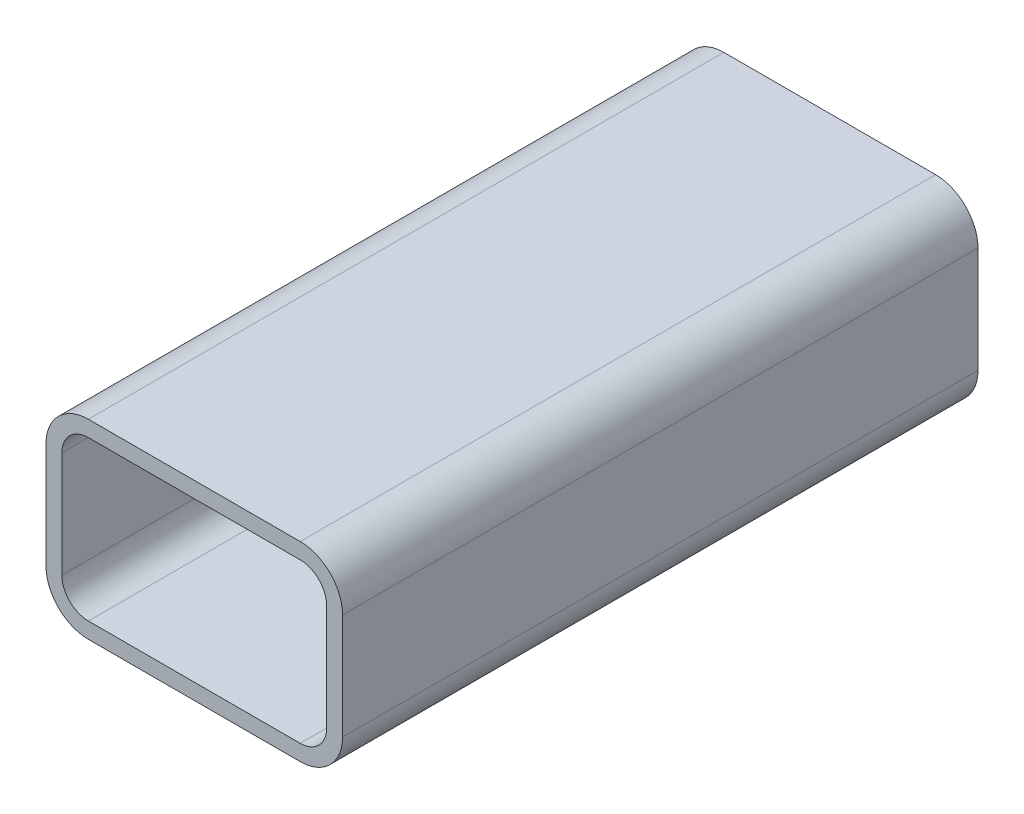
from build123d import *

# Parameters (mm, degrees)
EXTRUDE_THIN1_DEPTH = 60


with BuildPart() as part:
    # Sketch1 → Extrude-Thin1 (new, symmetric)
    with BuildSketch(Plane.XY):
        with BuildLine():
            Line((-20, 18), (20, 18))
            ThreePointArc((20, 18), (25.656854249, 15.656854249), (28, 10))
            Line((28, 10), (28, -10))
            ThreePointArc((28, -10), (25.656854249, -15.656854249), (20, -18))
            Line((20, -18), (-20, -18))
            ThreePointArc((-20, -18), (-25.656854249, -15.656854249), (-28, -10))
            Line((-28, -10), (-28, 10))
            ThreePointArc((-28, 10), (-25.656854249, 15.656854249), (-20, 18))
        make_face()
        with BuildLine():
            Line((-20, 15), (20, 15))
            ThreePointArc((20, 15), (23.535533906, 13.535533906), (25, 10))
            Line((25, 10), (25, -10))
            ThreePointArc((25, -10), (23.535533906, -13.535533906), (20, -15))
            Line((20, -15), (-20, -15))
            ThreePointArc((-20, -15), (-23.535533906, -13.535533906), (-25, -10))
            Line((-25, -10), (-25, 10))
            ThreePointArc((-25, 10), (-23.535533906, 13.535533906), (-20, 15))
        make_face(mode=Mode.SUBTRACT)
    extrude(amount=EXTRUDE_THIN1_DEPTH, both=True)


solid = part.part
